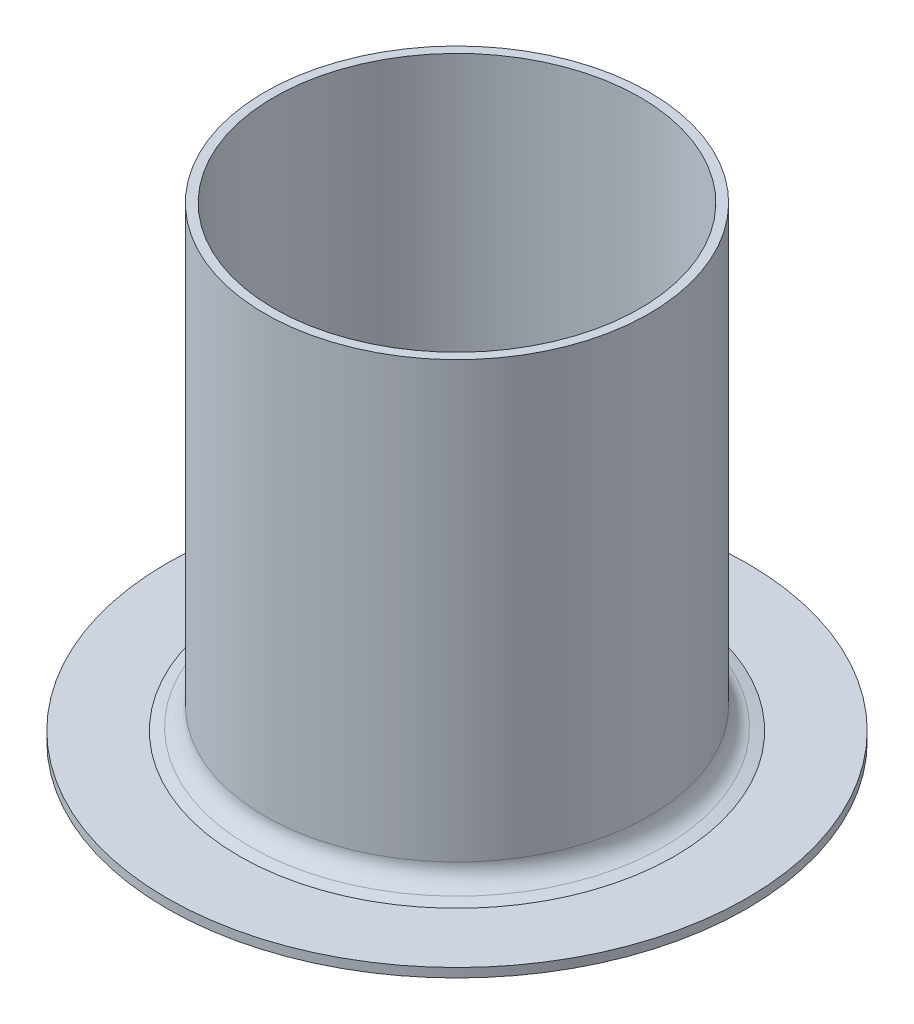
from build123d import *


with BuildPart() as part:
    # Sketch2 → Revolve1 (revolve)
    with BuildSketch(Plane.XY, mode=Mode.PRIVATE) as revolve1_sk:
        with BuildLine():
            Line((38.1, 0), (50.8, 0))
            Line((50.8, 0), (50.8, 1.5875))
            Line((50.8, 1.5875), (38.1, 1.5875))
            Line((38.1, 1.5875), (36.216874251, 2.092082024))
            ThreePointArc((36.216874251, 2.092082024), (34.360110092, 3.332732171), (33.6423, 5.447332512))
            Line((33.6423, 5.447332512), (33.6423, 81.647332512))
            Line((33.6423, 81.647332512), (32.0548, 81.647332512))
            Line((32.0548, 81.647332512), (32.0548, 5.517827557))
            ThreePointArc((32.0548, 5.517827557), (33.104565031, 2.425319498), (35.819999251, 0.610924359))
            Line((35.819999251, 0.610924359), (38.1, 0))
        make_face()
    revolve(revolve1_sk.sketch.rotate(Axis((0, 0, 0), (0, 1, 0)), 90), axis=Axis((0, 0, 0), (0, 1, 0)))


solid = part.part
